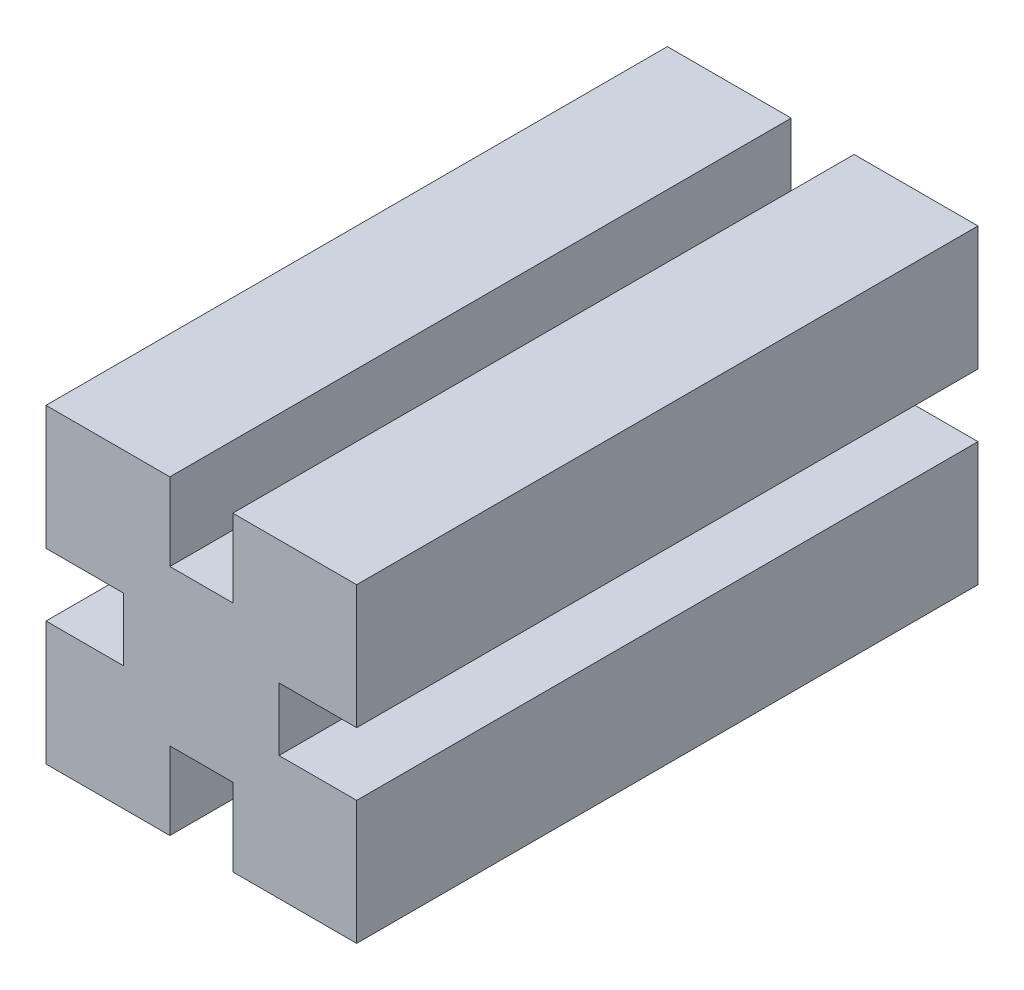
from build123d import *

# Parameters (mm, degrees)
BOSS_EXTRUDE1_DEPTH = 80


with BuildPart() as part:
    # Sketch1 → Boss-Extrude1 (new body)
    with BuildSketch(Plane.XY):
        Polygon((-4.05, 20), (-20, 20), (-20, 4.05), (-10, 4.05), (-10, -4.05), (-20, -4.05), (-20, -20), (-4.05, -20), (-4.05, -10), (4.05, -10), (4.05, -20), (20, -20), (20, -4.05), (10, -4.05), (10, 4.05), (20, 4.05), (20, 20), (4.05, 20), (4.05, 10), (-4.05, 10), align=None)
    extrude(amount=BOSS_EXTRUDE1_DEPTH)


solid = part.part
